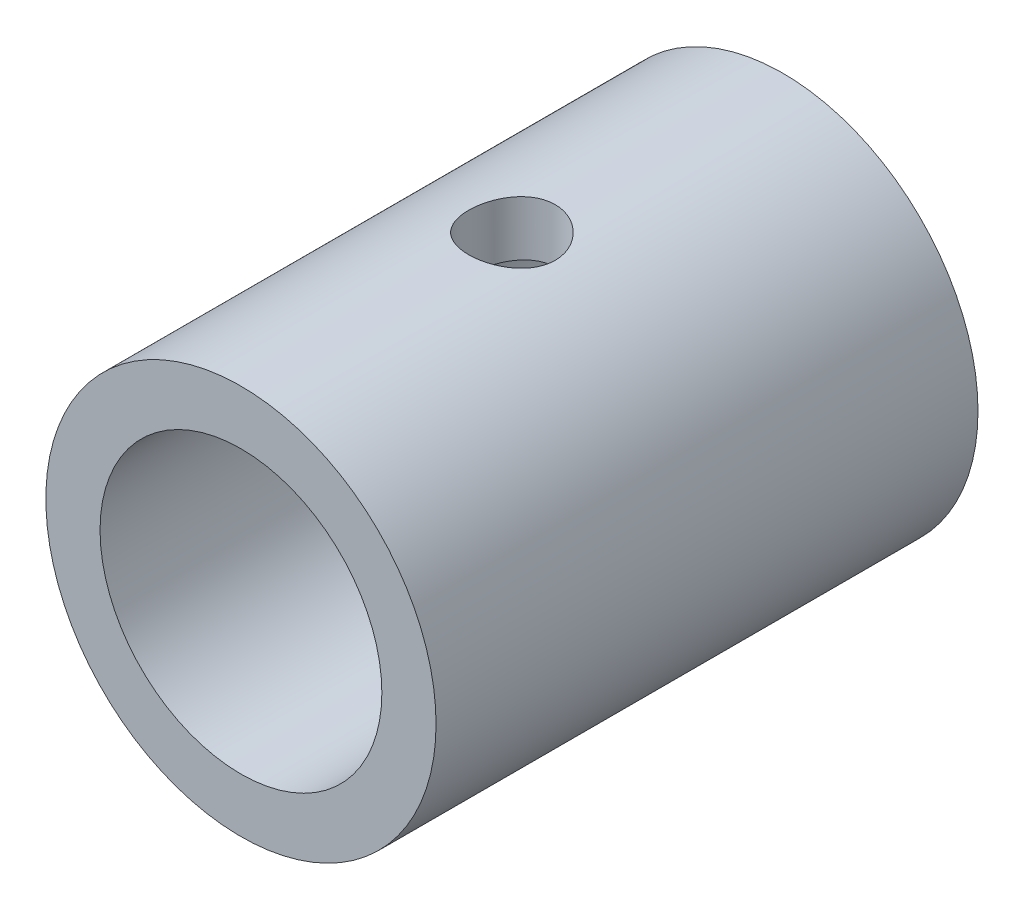
from build123d import *

# Parameters (mm, degrees)
SKETCH1_R           = 9
SKETCH1_R_2         = 6.5
BOSS_EXTRUDE1_DEPTH = 12.5
SKETCH2_R           = 2
CUT_EXTRUDE1_DEPTH  = 18.839562775


with BuildPart() as part:
    # Sketch1 → Boss-Extrude1 (new, symmetric)
    with BuildSketch(Plane.XY):
        Circle(SKETCH1_R)
        Circle(SKETCH1_R_2, mode=Mode.SUBTRACT)
    extrude(amount=BOSS_EXTRUDE1_DEPTH, both=True)

    # Sketch2 → Cut-Extrude1 (cut, through all)
    with BuildSketch(Plane(origin=(0, 0, 0), x_dir=(1, 0, 0), z_dir=(0, 1, 0))):
        with Locations(Location((0, 0, 0), (0, 0, 90))):
            Circle(SKETCH2_R)
    extrude(amount=CUT_EXTRUDE1_DEPTH, mode=Mode.SUBTRACT)


solid = part.part
